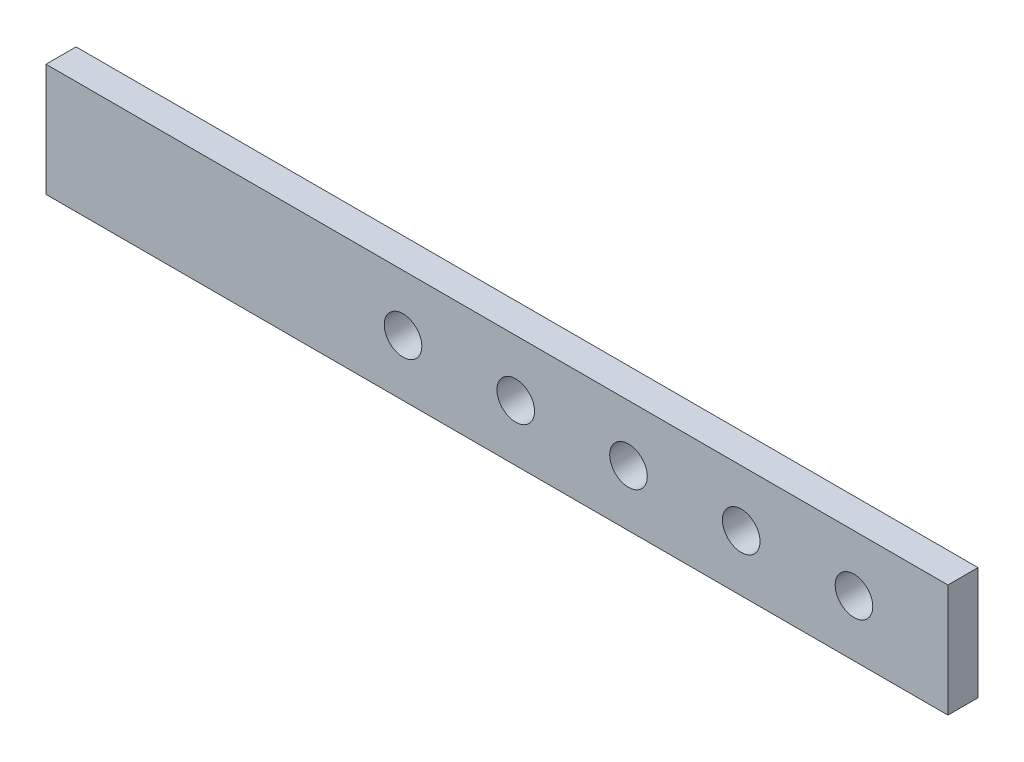
from build123d import *

# Parameters (mm, degrees)
SKETCH1_W           = 304.8
SKETCH1_H           = 38.1
SKETCH1_R           = 6.35
BOSS_EXTRUDE1_DEPTH = 10.16


with BuildPart() as part:
    # Sketch1 → Boss-Extrude1 (new body)
    with BuildSketch(Plane.XY):
        with Locations((-22.248944193, 37.171715756)):
            Rectangle(SKETCH1_W, SKETCH1_H)
        with Locations((98.401055807, 37.171715756)):
            Circle(SKETCH1_R, mode=Mode.SUBTRACT)
        with Locations((60.301055807, 37.171715756)):
            Circle(SKETCH1_R, mode=Mode.SUBTRACT)
        with Locations((22.201055807, 37.171715756)):
            Circle(SKETCH1_R, mode=Mode.SUBTRACT)
        with Locations((-15.898944193, 37.171715756)):
            Circle(SKETCH1_R, mode=Mode.SUBTRACT)
        with Locations((-53.998944193, 37.171715756)):
            Circle(SKETCH1_R, mode=Mode.SUBTRACT)
    extrude(amount=BOSS_EXTRUDE1_DEPTH)


solid = part.part
